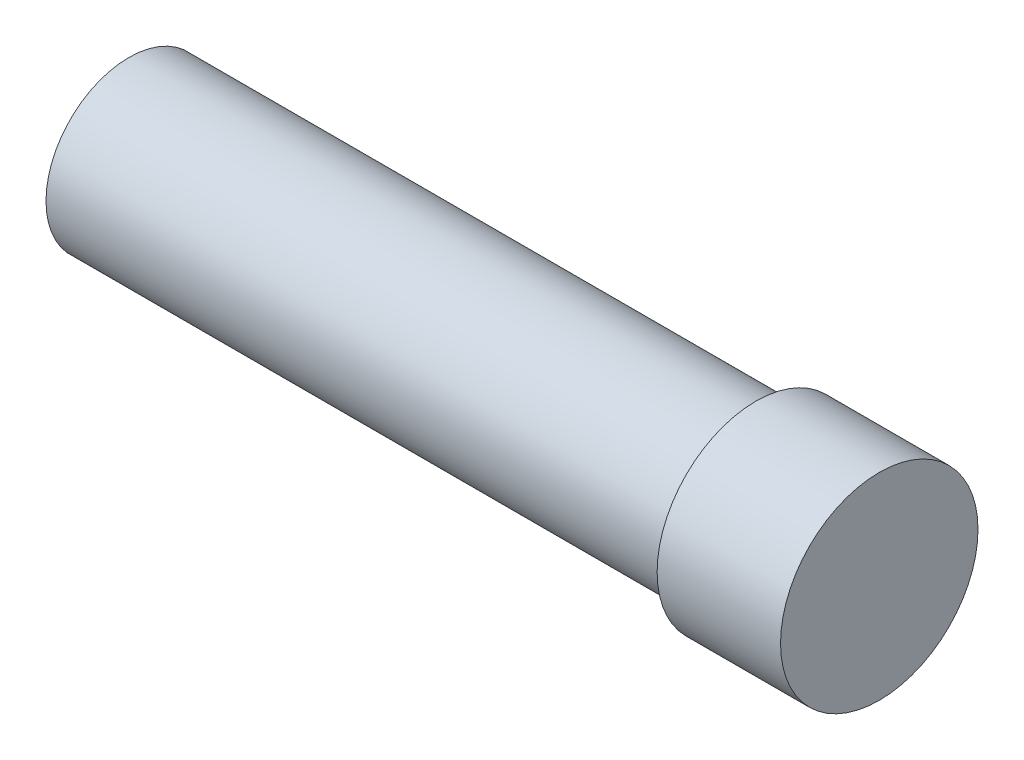
from build123d import *

# Parameters (mm, degrees)
SKETCH1_R                       = 5.08
BOSS_EXTRUDE1_DEPTH             = 6.35
SKETCH2_R                       = 4.2672
BOSS_EXTRUDE2_DEPTH             = 32.258
F_21_0_159_DIAMETER_HOLE1_D     = 3.999999874
F_21_0_159_DIAMETER_HOLE1_DEPTH = 12.7


with BuildPart() as part:
    # Sketch1 → Boss-Extrude1 (new body)
    with BuildSketch(Plane(origin=(0, 0, 0), x_dir=(0, 0, -1), z_dir=(1, 0, 0))):
        Circle(SKETCH1_R)
    extrude(amount=BOSS_EXTRUDE1_DEPTH)

    # Sketch2 → Boss-Extrude2 (add)
    with BuildSketch(Plane.ZY):
        with Locations(Location((0, 0, 0), (0, 0, 180))):
            Circle(SKETCH2_R)
    extrude(amount=BOSS_EXTRUDE2_DEPTH)

    # #21 (0.159) Diameter Hole1
    with Locations(Plane.ZY.offset(32.258)):
        with Locations((0, 0)):
            Hole(F_21_0_159_DIAMETER_HOLE1_D / 2, depth=F_21_0_159_DIAMETER_HOLE1_DEPTH)


solid = part.part
